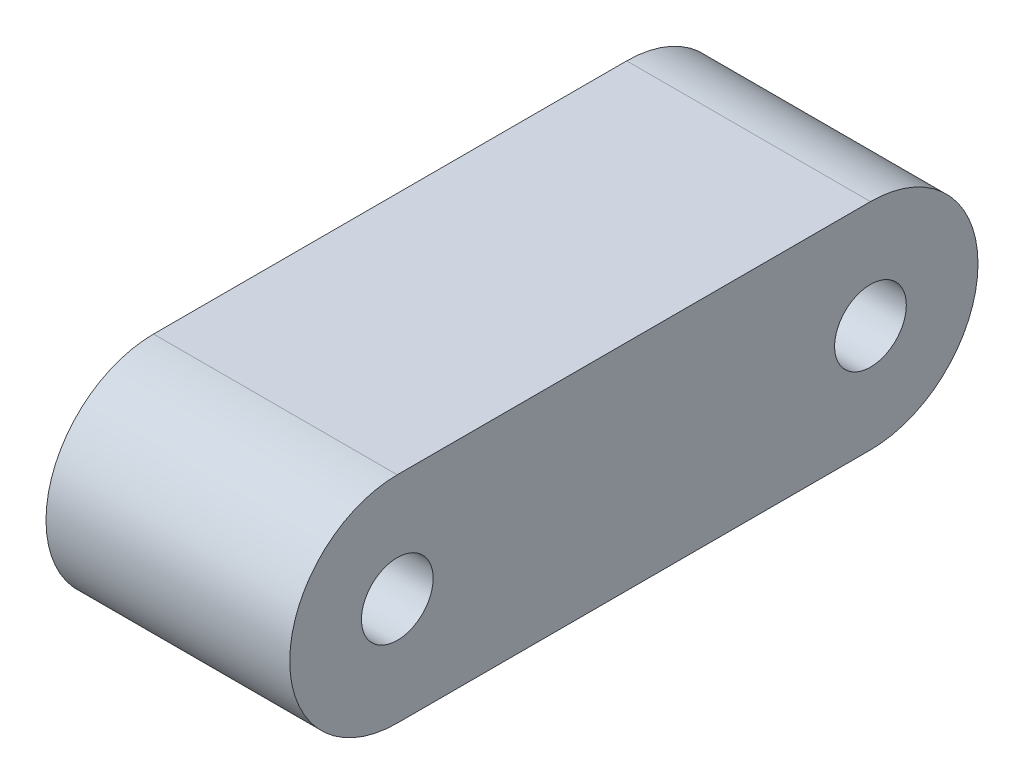
from build123d import *

# Parameters (mm, degrees)
CROQUIS1_R              = 2.5
SALIENTE_EXTRUIR1_DEPTH = 8.5


with BuildPart() as part:
    # Croquis1 → Saliente-Extruir1 (new, symmetric)
    with BuildSketch(Plane(origin=(0, 0, 0), x_dir=(0, 0, -1), z_dir=(1, 0, 0))):
        with BuildLine():
            Line((-16.5, 7.5), (16.5, 7.5))
            ThreePointArc((16.5, 7.5), (24, 0), (16.5, -7.5))
            Line((16.5, -7.5), (-16.5, -7.5))
            ThreePointArc((-16.5, -7.5), (-24, 0), (-16.5, 7.5))
        make_face()
        with Locations((-16.5, 0)):
            Circle(CROQUIS1_R, mode=Mode.SUBTRACT)
        with Locations((16.5, 0)):
            Circle(CROQUIS1_R, mode=Mode.SUBTRACT)
    extrude(amount=SALIENTE_EXTRUIR1_DEPTH, both=True)


solid = part.part
